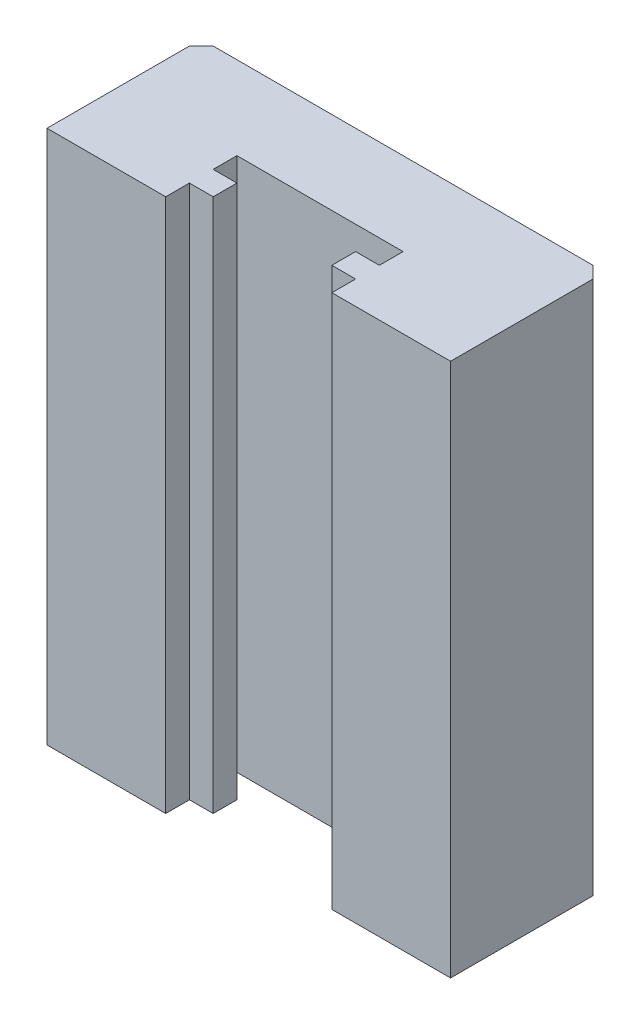
from build123d import *

# Parameters (mm, degrees)
EXTRUDE_1_DEPTH     = 22.5
SKETCH_2_R          = 1
CUT_EXTRUDE_1_DEPTH = 4
CHAMFER_1_SIZE      = 0.5


with BuildPart() as part:
    # 草图1 → 凸台-拉伸1 (new body)
    with BuildSketch(Plane(origin=(0, 0, 0), x_dir=(1, 0, 0), z_dir=(0, 1, 0))):
        Polygon((-8.5, 3.25), (-8.5, -3.25), (-3.5, -3.25), (-3.5, -2.25), (-2.5, -2.25), (-2.5, -1.25), (-3.5, -1.25), (-3.5, -0.25), (3.5, -0.25), (3.5, -1.25), (2.5, -1.25), (2.5, -2.25), (3.5, -2.25), (3.5, -3.25), (8.5, -3.25), (8.5, 3.25), align=None)
    extrude(amount=EXTRUDE_1_DEPTH)

    # 草图2 → 切除-拉伸1 (cut)
    with BuildSketch(Plane(origin=(0, 0, -3.25), x_dir=(-1, 0, 0), z_dir=(0, 0, -1))):
        with Locations((6, 15.25)):
            Circle(SKETCH_2_R)
        with Locations(Location((6, 7.25, 0), (0, 0, 180))):
            Circle(SKETCH_2_R)
        with Locations((-6, 7.25)):
            Circle(SKETCH_2_R)
        with Locations(Location((-6, 15.25, 0), (0, 0, 180))):
            Circle(SKETCH_2_R)
    extrude(amount=-CUT_EXTRUDE_1_DEPTH, mode=Mode.SUBTRACT)

    # 倒角1
    chamfer_1_edges = [part.edges().sort_by_distance(p)[0] for p in [
        (-8.5, 11.25, -3.25),
        (8.5, 11.25, -3.25),
    ]]
    chamfer(chamfer_1_edges, length=CHAMFER_1_SIZE)


solid = part.part
